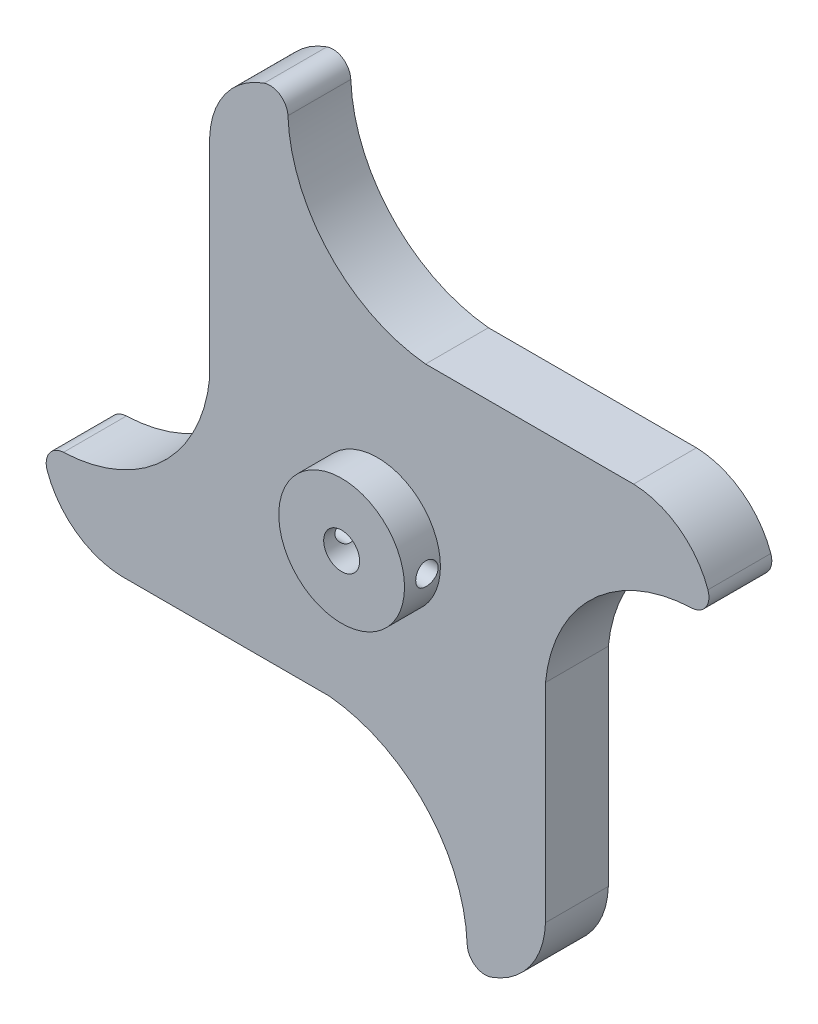
from build123d import *

# Parameters (mm, degrees)
SKETCH_1_R               = 2
EXTRUDE_1_DEPTH          = 7
SKETCH_5_R               = 7
SKETCH_5_R_2             = 2
EXTRUDE_2_DEPTH          = 4
CUT_EXTRUDE_5_DEPTH      = 8
CUT_EXTRUDE_5_DEPTH_BACK = 15
SKETCH_13_R              = 82.694540834
CUT_EXTRUDE_13_DEPTH     = 10
FILLET_1_R               = 2
FILLET_2_R               = 2
EXTRUDE_5_DEPTH          = 7
CUT_EXTRUDE_14_DEPTH     = 10
FILLET_3_R               = 3
FILLET_4_R               = 1
EXTRUDE_START            = -7
EXTRUDE_6_DEPTH          = 7
SKETCH_18_R              = 47.238796546
CUT_EXTRUDE_15_DEPTH     = 10
FILLET_5_R               = 2


with BuildPart() as part:
    # 草图1 → 凸台-拉伸1 (new body)
    with BuildSketch(Plane.XY):
        with BuildLine():
            ThreePointArc((32.8, 22.894540834), (36.610888994, 26.155959788), (40.879786515, 28.789634497))
            ThreePointArc((40.879786515, 28.789634497), (35.355339059, 35.355339059), (28.789634497, 40.879786515))
            ThreePointArc((28.789634497, 40.879786515), (26.155959788, 36.610888994), (22.894540834, 32.8))
            ThreePointArc((22.894540834, 32.8), (0, 23.316770682), (-22.894540834, 32.8))
            ThreePointArc((-22.894540834, 32.8), (-26.155959788, 36.610888994), (-28.789634497, 40.879786515))
            ThreePointArc((-28.789634497, 40.879786515), (-35.355339059, 35.355339059), (-40.879786515, 28.789634497))
            ThreePointArc((-40.879786515, 28.789634497), (-36.610888994, 26.155959788), (-32.8, 22.894540834))
            ThreePointArc((-32.8, 22.894540834), (-23.316770682, 0), (-32.8, -22.894540834))
            ThreePointArc((-32.8, -22.894540834), (-36.610888994, -26.155959788), (-40.879786515, -28.789634497))
            ThreePointArc((-40.879786515, -28.789634497), (-35.355339059, -35.355339059), (-28.789634497, -40.879786515))
            ThreePointArc((-28.789634497, -40.879786515), (-26.155959788, -36.610888994), (-22.894540834, -32.8))
            ThreePointArc((-22.894540834, -32.8), (0, -23.316770682), (22.894540834, -32.8))
            ThreePointArc((22.894540834, -32.8), (26.155959788, -36.610888994), (28.789634497, -40.879786515))
            ThreePointArc((28.789634497, -40.879786515), (35.355339059, -35.355339059), (40.879786515, -28.789634497))
            ThreePointArc((40.879786515, -28.789634497), (36.610888994, -26.155959788), (32.8, -22.894540834))
            ThreePointArc((32.8, -22.894540834), (23.316770682, 0), (32.8, 22.894540834))
        make_face()
        Circle(SKETCH_1_R, mode=Mode.SUBTRACT)
    extrude(amount=EXTRUDE_1_DEPTH)

    # 草图5 → 凸台-拉伸2 (add)
    with BuildSketch(Plane.XY.offset(7)):
        Circle(SKETCH_5_R)
        Circle(SKETCH_5_R_2, mode=Mode.SUBTRACT)
    extrude(amount=EXTRUDE_2_DEPTH)

    # 草图11 → 切除-拉伸5 (cut, two sides: drawn at the far end of the back side and taken through both)
    with BuildSketch(Plane(origin=(0, 0, 0), x_dir=(0, 0, -1), z_dir=(1, 0, 0)).offset(-CUT_EXTRUDE_5_DEPTH_BACK)):
        with BuildLine():
            ThreePointArc((-9.75, 0), (-8.5, -1.25), (-7.25, 0))
            Line((-7.25, 0), (-9.75, 0))
        make_face()
        with BuildLine():
            Line((-9.75, 0), (-7.25, 0))
            ThreePointArc((-7.25, 0), (-8.5, 1.25), (-9.75, 0))
        make_face()
    extrude(amount=CUT_EXTRUDE_5_DEPTH + CUT_EXTRUDE_5_DEPTH_BACK, mode=Mode.SUBTRACT)

    # 草图13 → 切除-拉伸13 (cut)
    with BuildSketch(Plane(origin=(0, 0, 0), x_dir=(-1, 0, 0), z_dir=(0, 0, -1))):
        Circle(SKETCH_13_R)
        with BuildLine():
            ThreePointArc((-25.243635923, 31.028355505), (0, 18.694540834), (25.243635923, 31.028355505))
            ThreePointArc((25.243635923, 31.028355505), (28.284271247, 28.284271247), (31.028355505, 25.243635923))
            ThreePointArc((31.028355505, 25.243635923), (18.694540834, 0), (31.028355505, -25.243635923))
            ThreePointArc((31.028355505, -25.243635923), (28.284271247, -28.284271247), (25.243635923, -31.028355505))
            ThreePointArc((25.243635923, -31.028355505), (0, -18.694540834), (-25.243635923, -31.028355505))
            ThreePointArc((-25.243635923, -31.028355505), (-28.284271247, -28.284271247), (-31.028355505, -25.243635923))
            ThreePointArc((-31.028355505, -25.243635923), (-18.694540834, 0), (-31.028355505, 25.243635923))
            ThreePointArc((-31.028355505, 25.243635923), (-28.284271247, 28.284271247), (-25.243635923, 31.028355505))
        make_face(mode=Mode.SUBTRACT)
    extrude(amount=-CUT_EXTRUDE_13_DEPTH, mode=Mode.SUBTRACT)

    # 圆角1
    fillet_1_edges = [part.edges().sort_by_distance(p)[0] for p in [
        (25.243635923, 31.028355505, 3.5),
        (-31.028355505, 25.243635923, 3.5),
        (-31.028355505, -25.243635923, 3.5),
        (31.028355505, -25.243635923, 3.5),
    ]]
    fillet(fillet_1_edges, radius=FILLET_1_R)

    # 圆角2
    fillet_2_edges = [part.edges().sort_by_distance(p)[0] for p in [
        (-25.243635923, 31.028355505, 3.5),
        (-25.243635923, -31.028355505, 3.5),
        (25.243635923, -31.028355505, 3.5),
        (31.028355505, 25.243635923, 3.5),
    ]]
    fillet(fillet_2_edges, radius=FILLET_2_R)

    # 草图14 → 凸台-拉伸5 (add)
    with BuildSketch(Plane(origin=(0, 0, 0), x_dir=(-1, 0, 0), z_dir=(0, 0, -1))):
        with BuildLine():
            ThreePointArc((13.801737807, 34.095635208), (10.090539986, 23.536654529), (0, 18.694540834))
            ThreePointArc((0, 18.694540834), (9.821274778, 20.238957409), (18.694540834, 24.723130726))
            Line((18.694540834, 24.723130726), (18.694540834, 34.095635208))
            Line((18.694540834, 34.095635208), (13.801737807, 34.095635208))
        make_face()
        with BuildLine():
            ThreePointArc((-18.694540834, 0), (-20.238957409, 9.821274778), (-24.723130726, 18.694540834))
            Line((-24.723130726, 18.694540834), (-34.095635208, 18.694540834))
            Line((-34.095635208, 18.694540834), (-34.095635208, 13.801737807))
            ThreePointArc((-34.095635208, 13.801737807), (-23.536654529, 10.090539986), (-18.694540834, 0))
        make_face()
        with BuildLine():
            ThreePointArc((34.095635208, -13.801737807), (23.536654529, -10.090539986), (18.694540834, 0))
            ThreePointArc((18.694540834, 0), (20.238957409, -9.821274778), (24.723130726, -18.694540834))
            Line((24.723130726, -18.694540834), (34.095635208, -18.694540834))
            Line((34.095635208, -18.694540834), (34.095635208, -13.801737807))
        make_face()
        with BuildLine():
            ThreePointArc((0, -18.694540834), (-9.821274778, -20.238957409), (-18.694540834, -24.723130726))
            Line((-18.694540834, -24.723130726), (-18.694540834, -34.095635208))
            Line((-18.694540834, -34.095635208), (-13.801737807, -34.095635208))
            ThreePointArc((-13.801737807, -34.095635208), (-10.090539986, -23.536654529), (0, -18.694540834))
        make_face()
    extrude(amount=-EXTRUDE_5_DEPTH)

    # 草图15 → 切除-拉伸14 (cut)
    with BuildSketch(Plane(origin=(0, 0, 0), x_dir=(-1, 0, 0), z_dir=(0, 0, -1))):
        with BuildLine():
            Line((-24.723130726, 18.694540834), (-33.334723843, 25.692106251))
            Line((-33.334723843, 25.692106251), (-12.530174443, 42.497606237))
            Line((-12.530174443, 42.497606237), (0, 18.694540834))
            ThreePointArc((0, 18.694540834), (-13.155803158, 21.523924741), (-23.985180208, 29.51173813))
            ThreePointArc((-23.985180208, 29.51173813), (-25.372019669, 30.184661343), (-26.825530496, 29.671382064))
            ThreePointArc((-26.825530496, 29.671382064), (-28.284271247, 28.284271247), (-29.671382064, 26.825530496))
            ThreePointArc((-29.671382064, 26.825530496), (-30.184661343, 25.372019669), (-29.51173813, 23.985180208))
            ThreePointArc((-29.51173813, 23.985180208), (-26.969497889, 21.473759272), (-24.723130726, 18.694540834))
        make_face()
        with BuildLine():
            Line((-24.723130726, 18.694540834), (0, 18.694540834))
            ThreePointArc((0, 18.694540834), (-13.155803158, 21.523924741), (-23.985180208, 29.51173813))
            ThreePointArc((-23.985180208, 29.51173813), (-25.372019669, 30.184661343), (-26.825530496, 29.671382064))
            ThreePointArc((-26.825530496, 29.671382064), (-28.284271247, 28.284271247), (-29.671382064, 26.825530496))
            ThreePointArc((-29.671382064, 26.825530496), (-30.184661343, 25.372019669), (-29.51173813, 23.985180208))
            ThreePointArc((-29.51173813, 23.985180208), (-26.969497889, 21.473759272), (-24.723130726, 18.694540834))
        make_face()
        with BuildLine():
            Line((18.694540834, 0), (18.694540834, 24.723130726))
            ThreePointArc((18.694540834, 24.723130726), (21.473759272, 26.969497889), (23.985180208, 29.51173813))
            ThreePointArc((23.985180208, 29.51173813), (25.372019669, 30.184661343), (26.825530496, 29.671382064))
            ThreePointArc((26.825530496, 29.671382064), (28.284271247, 28.284271247), (29.671382064, 26.825530496))
            ThreePointArc((29.671382064, 26.825530496), (30.184661343, 25.372019669), (29.51173813, 23.985180208))
            ThreePointArc((29.51173813, 23.985180208), (21.523924741, 13.155803158), (18.694540834, 0))
        make_face()
        with BuildLine():
            Line((18.694540834, 24.723130726), (25.692106251, 33.334723843))
            Line((25.692106251, 33.334723843), (42.497606237, 12.530174443))
            Line((42.497606237, 12.530174443), (18.694540834, 0))
            ThreePointArc((18.694540834, 0), (21.523924741, 13.155803158), (29.51173813, 23.985180208))
            ThreePointArc((29.51173813, 23.985180208), (30.184661343, 25.372019669), (29.671382064, 26.825530496))
            ThreePointArc((29.671382064, 26.825530496), (28.284271247, 28.284271247), (26.825530496, 29.671382064))
            ThreePointArc((26.825530496, 29.671382064), (25.372019669, 30.184661343), (23.985180208, 29.51173813))
            ThreePointArc((23.985180208, 29.51173813), (21.473759272, 26.969497889), (18.694540834, 24.723130726))
        make_face()
        with BuildLine():
            ThreePointArc((29.51173813, -23.985180208), (26.969497889, -21.473759272), (24.723130726, -18.694540834))
            Line((24.723130726, -18.694540834), (0.927061706, -18.707972456))
            ThreePointArc((0.927061706, -18.707972456), (13.577013202, -21.717572178), (23.985180208, -29.51173813))
            ThreePointArc((23.985180208, -29.51173813), (25.372019669, -30.184661343), (26.825530496, -29.671382064))
            ThreePointArc((26.825530496, -29.671382064), (28.284271247, -28.284271247), (29.671382064, -26.825530496))
            ThreePointArc((29.671382064, -26.825530496), (30.184661343, -25.372019669), (29.51173813, -23.985180208))
        make_face()
        with BuildLine():
            Line((24.723130726, -18.694540834), (33.334723843, -25.692106251))
            Line((33.334723843, -25.692106251), (12.530174443, -42.497606237))
            Line((12.530174443, -42.497606237), (0, -18.694540834))
            ThreePointArc((0, -18.694540834), (13.155803158, -21.523924741), (23.985180208, -29.51173813))
            ThreePointArc((23.985180208, -29.51173813), (25.372019669, -30.184661343), (26.825530496, -29.671382064))
            ThreePointArc((26.825530496, -29.671382064), (28.284271247, -28.284271247), (29.671382064, -26.825530496))
            ThreePointArc((29.671382064, -26.825530496), (30.184661343, -25.372019669), (29.51173813, -23.985180208))
            ThreePointArc((29.51173813, -23.985180208), (26.969497889, -21.473759272), (24.723130726, -18.694540834))
        make_face()
        with BuildLine():
            Line((-42.497606237, -12.530174443), (-18.694540834, 0))
            ThreePointArc((-18.694540834, 0), (-21.523924741, -13.155803158), (-29.51173813, -23.985180208))
            ThreePointArc((-29.51173813, -23.985180208), (-30.184661343, -25.372019669), (-29.671382064, -26.825530496))
            ThreePointArc((-29.671382064, -26.825530496), (-28.284271247, -28.284271247), (-26.825530496, -29.671382064))
            ThreePointArc((-26.825530496, -29.671382064), (-25.372019669, -30.184661343), (-23.985180208, -29.51173813))
            ThreePointArc((-23.985180208, -29.51173813), (-21.473759272, -26.969497889), (-18.694540834, -24.723130726))
            Line((-18.694540834, -24.723130726), (-25.692106251, -33.334723843))
            Line((-25.692106251, -33.334723843), (-42.497606237, -12.530174443))
        make_face()
        with BuildLine():
            Line((-18.694540834, -24.723130726), (-18.694540834, 0))
            ThreePointArc((-18.694540834, 0), (-21.523924741, -13.155803158), (-29.51173813, -23.985180208))
            ThreePointArc((-29.51173813, -23.985180208), (-30.184661343, -25.372019669), (-29.671382064, -26.825530496))
            ThreePointArc((-29.671382064, -26.825530496), (-28.284271247, -28.284271247), (-26.825530496, -29.671382064))
            ThreePointArc((-26.825530496, -29.671382064), (-25.372019669, -30.184661343), (-23.985180208, -29.51173813))
            ThreePointArc((-23.985180208, -29.51173813), (-21.473759272, -26.969497889), (-18.694540834, -24.723130726))
        make_face()
    extrude(amount=-CUT_EXTRUDE_14_DEPTH, mode=Mode.SUBTRACT)

    # 圆角3
    fillet_3_edges = [part.edges().sort_by_distance(p)[0] for p in [
        (34.095635208, 18.694540834, 3.5),
        (-18.694540834, 34.095635208, 3.5),
        (-34.095635208, -18.694540834, 3.5),
        (18.694540834, -34.095635208, 3.5),
    ]]
    fillet(fillet_3_edges, radius=FILLET_3_R)

    # 圆角4
    fillet_4_edges = [part.edges().sort_by_distance(p)[0] for p in [
        (-13.801737807, 34.095635208, 3.5),
        (-34.095635208, -13.801737807, 3.5),
        (13.801737807, -34.095635208, 3.5),
        (34.095635208, 13.801737807, 3.5),
    ]]
    fillet(fillet_4_edges, radius=FILLET_4_R)

    # 草图16 → 凸台-拉伸6 (add)
    with BuildSketch(Plane(origin=(0, 0, 0), x_dir=(-1, 0, 0), z_dir=(0, 0, -1)).offset(EXTRUDE_START)):
        with BuildLine():
            ThreePointArc((9.910873566, 37.290487321), (6.133427391, 24.832564637), (-5.346712023, 18.694540834))
            Line((-5.346712023, 18.694540834), (0, 18.694540834))
            ThreePointArc((0, 18.694540834), (9.754847949, 23.174553207), (13.822417362, 33.108457194))
            ThreePointArc((13.822417362, 33.108457194), (14.119776258, 33.807260807), (14.822335157, 34.095635208))
            Line((14.822335157, 34.095635208), (15.694540834, 34.095635208))
            ThreePointArc((15.694540834, 34.095635208), (16.201960761, 34.052411326), (16.694758916, 33.923985219))
            ThreePointArc((16.694758916, 33.923985219), (13.671949052, 36.351080947), (9.910873566, 37.290487321))
        make_face()
        with BuildLine():
            ThreePointArc((-37.290487321, 9.910873566), (-24.832564637, 6.133427391), (-18.694540834, -5.346712023))
            Line((-18.694540834, -5.346712023), (-18.694540834, 0))
            ThreePointArc((-18.694540834, 0), (-23.174553207, 9.754847949), (-33.108457194, 13.822417362))
            ThreePointArc((-33.108457194, 13.822417362), (-33.807260807, 14.119776258), (-34.095635208, 14.822335157))
            Line((-34.095635208, 14.822335157), (-34.095635208, 15.694540834))
            ThreePointArc((-34.095635208, 15.694540834), (-34.052411326, 16.201960761), (-33.923985219, 16.694758916))
            ThreePointArc((-33.923985219, 16.694758916), (-36.351080947, 13.671949052), (-37.290487321, 9.910873566))
        make_face()
        with BuildLine():
            ThreePointArc((-9.910873566, -37.290487321), (-6.167788996, -24.874581099), (5.238714674, -18.705538756))
            Line((5.238714674, -18.705538756), (0.927061706, -18.707972456))
            ThreePointArc((0.927061706, -18.707972456), (0.463579501, -18.697898916), (0, -18.694540834))
            ThreePointArc((0, -18.694540834), (-9.754847949, -23.174553207), (-13.822417362, -33.108457194))
            ThreePointArc((-13.822417362, -33.108457194), (-14.119776258, -33.807260807), (-14.822335157, -34.095635208))
            Line((-14.822335157, -34.095635208), (-15.694540834, -34.095635208))
            ThreePointArc((-15.694540834, -34.095635208), (-16.201960761, -34.052411326), (-16.694758916, -33.923985219))
            ThreePointArc((-16.694758916, -33.923985219), (-13.671949052, -36.351080947), (-9.910873566, -37.290487321))
        make_face()
        with BuildLine():
            ThreePointArc((37.290487321, -9.910873566), (24.832564637, -6.133427391), (18.694540834, 5.346712023))
            Line((18.694540834, 5.346712023), (18.694540834, 0))
            ThreePointArc((18.694540834, 0), (23.174553207, -9.754847949), (33.108457194, -13.822417362))
            ThreePointArc((33.108457194, -13.822417362), (33.807260807, -14.119776258), (34.095635208, -14.822335157))
            Line((34.095635208, -14.822335157), (34.095635208, -15.694540834))
            ThreePointArc((34.095635208, -15.694540834), (34.052411326, -16.201960761), (33.923985219, -16.694758916))
            ThreePointArc((33.923985219, -16.694758916), (36.351080947, -13.671949052), (37.290487321, -9.910873566))
        make_face()
    extrude(amount=EXTRUDE_6_DEPTH)

    # 草图18 → 切除-拉伸15 (cut)
    with BuildSketch(Plane.XY.offset(7)):
        Circle(SKETCH_18_R)
        with BuildLine():
            Line((5.346712023, 18.694540834), (27.984188654, 18.694540834))
            ThreePointArc((27.984188654, 18.694540834), (34.456495042, 16.230104762), (37.290487321, 9.910873566))
            ThreePointArc((37.290487321, 9.910873566), (24.832564637, 6.133427391), (18.694540834, -5.346712023))
            Line((18.694540834, -5.346712023), (18.694540834, -27.984188654))
            ThreePointArc((18.694540834, -27.984188654), (16.230104762, -34.456495042), (9.910873566, -37.290487321))
            ThreePointArc((9.910873566, -37.290487321), (6.133427391, -24.832564637), (-5.346712023, -18.694540834))
            Line((-5.346712023, -18.694540834), (-27.984188654, -18.694540834))
            ThreePointArc((-27.984188654, -18.694540834), (-34.456495042, -16.230104762), (-37.290487321, -9.910873566))
            ThreePointArc((-37.290487321, -9.910873566), (-24.832564637, -6.133427391), (-18.694540834, 5.346712023))
            Line((-18.694540834, 5.346712023), (-18.694540834, 27.984188654))
            ThreePointArc((-18.694540834, 27.984188654), (-16.230104762, 34.456495042), (-9.910873566, 37.290487321))
            ThreePointArc((-9.910873566, 37.290487321), (-6.133427391, 24.832564637), (5.346712023, 18.694540834))
        make_face(mode=Mode.SUBTRACT)
    extrude(amount=-CUT_EXTRUDE_15_DEPTH, mode=Mode.SUBTRACT)

    # 圆角5
    fillet_5_edges = [part.edges().sort_by_distance(p)[0] for p in [
        (-9.910873566, 37.290487321, 3.5),
        (37.290487321, 9.910873566, 3.5),
        (9.910873566, -37.290487321, 3.5),
        (-37.290487321, -9.910873566, 3.5),
    ]]
    fillet(fillet_5_edges, radius=FILLET_5_R)


solid = part.part
